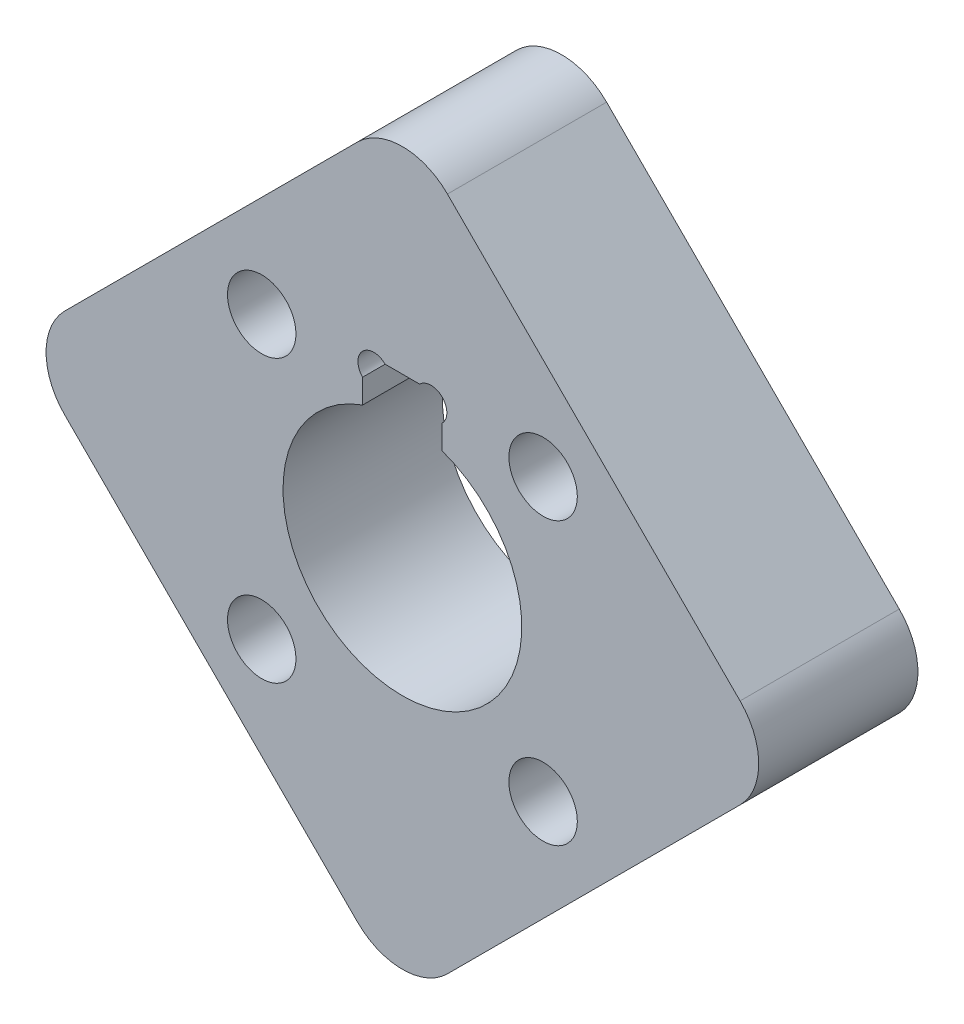
from build123d import *

# Parameters (mm, degrees)
EXTRUDE_1_DEPTH    = 10
HOLE_WIZARD_M4_1_D = 4.3


with BuildPart() as part:
    # ｽｹｯﾁ1 → ﾎﾞｽ - 押し出し1 (new body)
    with BuildSketch(Plane.XY):
        with BuildLine():
            Line((-21.213203436, -2.828427125), (-2.828427125, -21.213203436))
            ThreePointArc((-2.828427125, -21.213203436), (0, -22.384776311), (2.828427125, -21.213203436))
            Line((2.828427125, -21.213203436), (21.213203436, -2.828427125))
            ThreePointArc((21.213203436, -2.828427125), (22.384776311, 0), (21.213203436, 2.828427125))
            Line((21.213203436, 2.828427125), (2.828427125, 21.213203436))
            ThreePointArc((2.828427125, 21.213203436), (0, 22.384776311), (-2.828427125, 21.213203436))
            Line((-2.828427125, 21.213203436), (-21.213203436, 2.828427125))
            ThreePointArc((-21.213203436, 2.828427125), (-22.384776311, 0), (-21.213203436, -2.828427125))
        make_face()
        with BuildLine():
            Line((-2.5, 8.585786438), (-2.5, 7.071067812))
            ThreePointArc((-2.5, 7.071067812), (0, -7.5), (2.5, 7.071067812))
            Line((2.5, 7.071067812), (2.5, 8.585786438))
            ThreePointArc((2.5, 8.585786438), (2.5, 10), (1.085786438, 10))
            Line((1.085786438, 10), (-1.085786438, 10))
            ThreePointArc((-1.085786438, 10), (-2.5, 10), (-2.5, 8.585786438))
        make_face(mode=Mode.SUBTRACT)
    extrude(amount=EXTRUDE_1_DEPTH)

    # Hole Wizard M4 _1 (through all)
    with Locations(Plane(origin=(-8.838834765, 8.838834765, 10), x_dir=(1, 0, 0), z_dir=(0, 0, 1))):
        with Locations((0, 0), (17.67766953, 0), (17.67766953, -17.67766953), (0, -17.67766953)):
            Hole(HOLE_WIZARD_M4_1_D / 2)


solid = part.part
